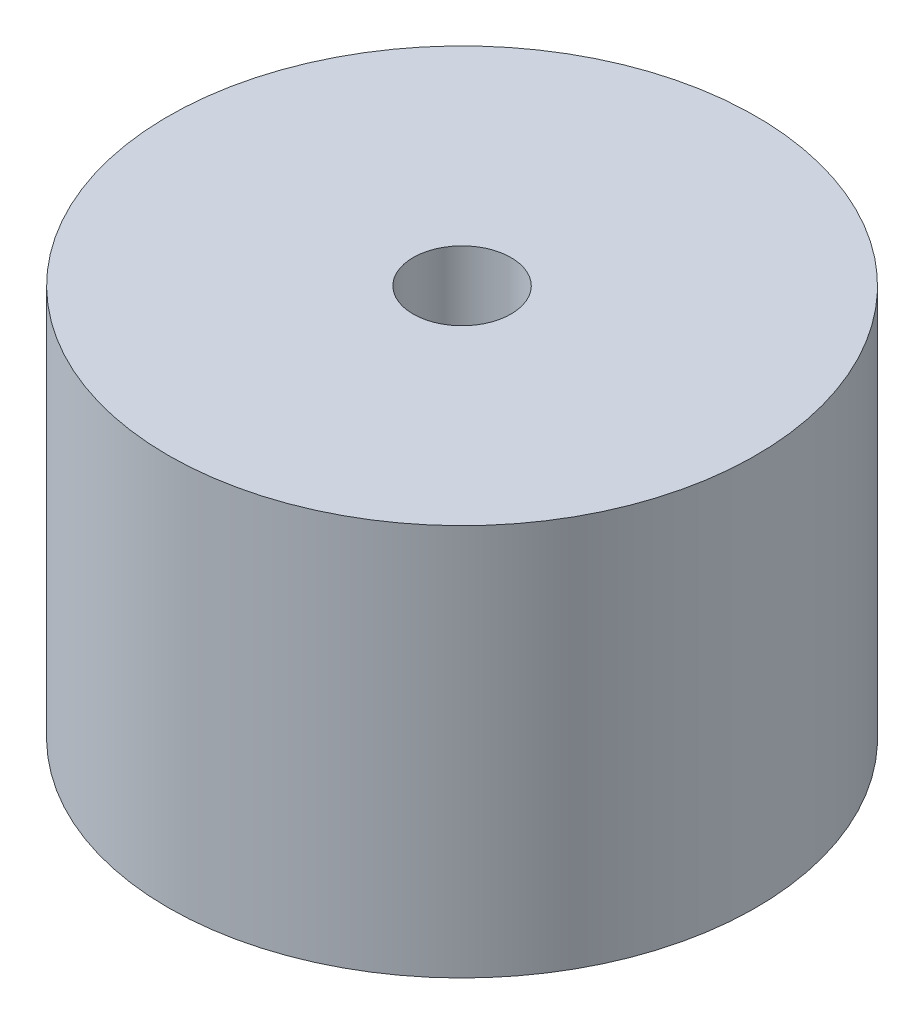
from build123d import *

# Parameters (mm, degrees)
SKETCH1_R           = 9
SKETCH1_R_2         = 1.5
BOSS_EXTRUDE1_DEPTH = 12


with BuildPart() as part:
    # Sketch1 → Boss-Extrude1 (new body)
    with BuildSketch(Plane(origin=(0, 0, 0), x_dir=(1, 0, 0), z_dir=(0, 1, 0))):
        with Locations(Location((0, 0, 0), (0, 0, 270))):
            Circle(SKETCH1_R)
        with Locations(Location((0, 0, 0), (0, 0, 270))):
            Circle(SKETCH1_R_2, mode=Mode.SUBTRACT)
    extrude(amount=BOSS_EXTRUDE1_DEPTH)


solid = part.part
